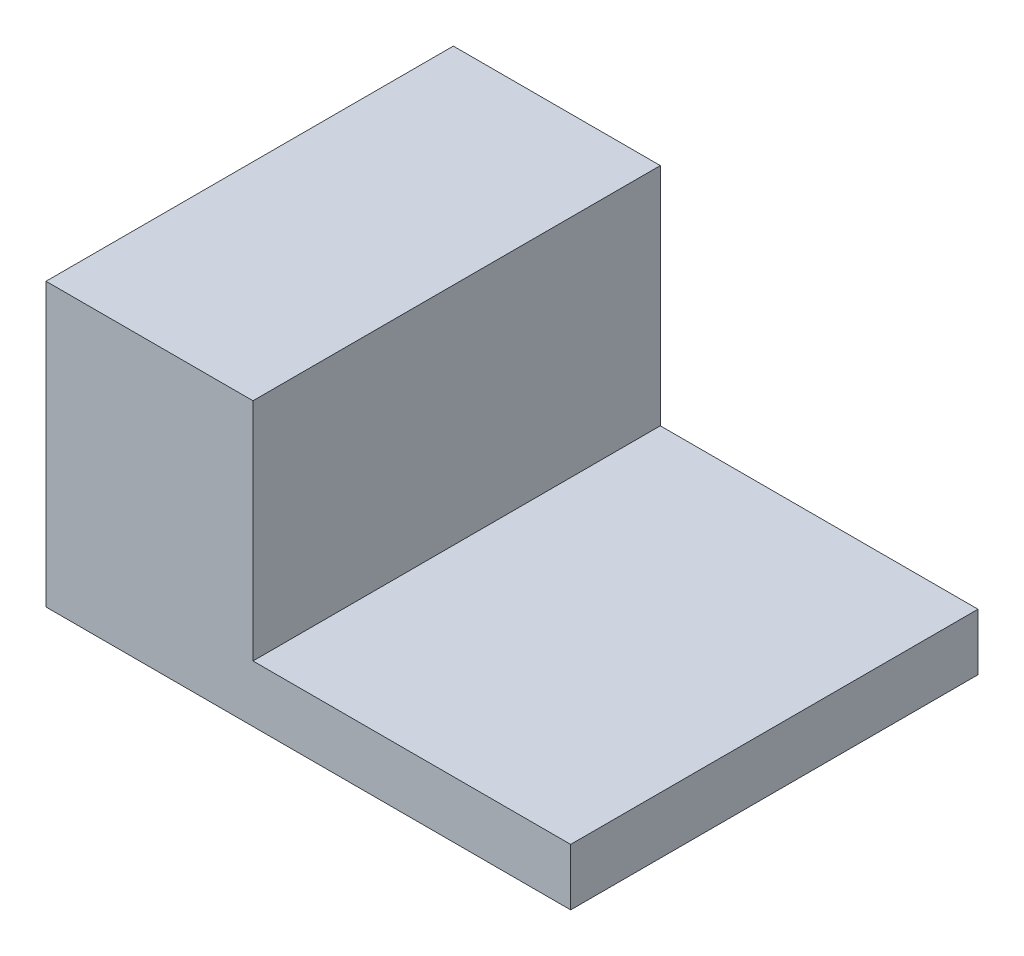
from build123d import *

# Parameters (mm, degrees)
EXTRUDE2_DEPTH = 50.8


with BuildPart() as part:
    # Sketch2 → Extrude2 (new body)
    with BuildSketch(Plane.XY):
        Polygon((0, 35.184542787), (0, 0), (65.432354884, 0), (65.432354884, 7.078767645), (25.813370646, 7.078767645), (25.813370646, 35.184542787), align=None)
    extrude(amount=EXTRUDE2_DEPTH)


solid = part.part
